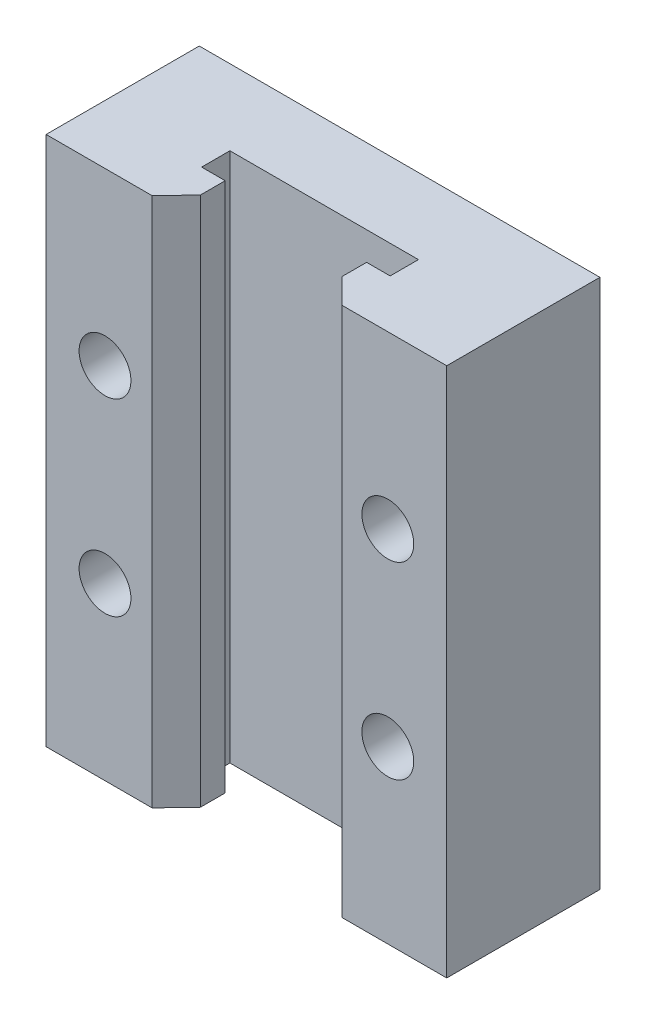
from build123d import *

# Parameters (mm, degrees)
EXTRUDE_1_DEPTH     = 22.5
SKETCH_2_R          = 1.1
CUT_EXTRUDE_1_DEPTH = 10


with BuildPart() as part:
    # 草图1 → 凸台-拉伸1 (new body)
    with BuildSketch(Plane(origin=(0, 0, 0), x_dir=(1, 0, 0), z_dir=(0, 1, 0))):
        Polygon((-4, 0.824883125), (-3, 0.824883125), (-3, -0.225116875), (-4, -1.275116875), (-8.5, -1.275116875), (-8.5, 5.224883125), (8.5, 5.224883125), (8.5, -1.275116875), (4.05, -1.275116875), (3, -0.225116875), (3, 0.824883125), (4, 0.824883125), (4, 2.024883125), (-4, 2.024883125), align=None)
    extrude(amount=EXTRUDE_1_DEPTH)

    # 草图2 → 切除-拉伸1 (cut)
    with BuildSketch(Plane(origin=(0, 0, -5.224883125), x_dir=(-1, 0, 0), z_dir=(0, 0, -1))):
        with Locations((-6, 15.25)):
            Circle(SKETCH_2_R)
        with Locations((6, 15.25)):
            Circle(SKETCH_2_R)
        with Locations((6, 7.25)):
            Circle(SKETCH_2_R)
        with Locations((-6, 7.25)):
            Circle(SKETCH_2_R)
    extrude(amount=-CUT_EXTRUDE_1_DEPTH, mode=Mode.SUBTRACT)


solid = part.part
